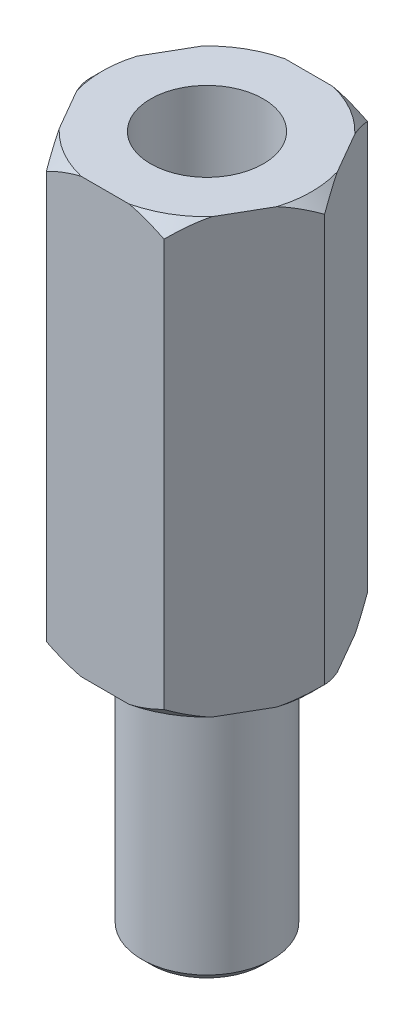
from build123d import *

# Parameters (mm, degrees)
SKETCH1_R                = 1.3
BOSS_EXTRUDE1_DEPTH      = 10
BOSS_EXTRUDE2_DEPTH      = 6
BOSS_EXTRUDE2_DEPTH_BACK = 2
SKETCH2_R                = 1.5
CHAMFER1_SIZE            = 0.2


with BuildPart() as part:
    # Sketch1 → Boss-Extrude1 (new body)
    with BuildSketch(Plane(origin=(0, 0, 0), x_dir=(1, 0, 0), z_dir=(0, 1, 0))):
        Polygon((-2.713546265, 0), (-1.356773133, -2.35), (1.356773133, -2.35), (2.713546265, 0), (1.356773133, 2.35), (-1.356773133, 2.35), align=None)
        with Locations(Location((0, 0, 0), (0, 0, 270))):
            Circle(SKETCH1_R, mode=Mode.SUBTRACT)
    extrude(amount=BOSS_EXTRUDE1_DEPTH)

    # Sketch2 → Boss-Extrude2 (add, two sides: drawn at the far end of the back side and taken through both)
    with BuildSketch(Plane.XZ.offset(-BOSS_EXTRUDE2_DEPTH_BACK)):
        with Locations(Location((0, 0, 0), (0, 0, 270))):
            Circle(SKETCH2_R)
    extrude(amount=BOSS_EXTRUDE2_DEPTH + BOSS_EXTRUDE2_DEPTH_BACK)

    # Chamfer1
    chamfer1_edges = [part.edges().sort_by_distance(p)[0] for p in [
        (0, -6, 1.5),
    ]]
    chamfer(chamfer1_edges, length=CHAMFER1_SIZE)

    # Sketch6 → Cut-Revolve1 (revolve, cut)
    with BuildSketch(Plane.XY, mode=Mode.PRIVATE) as cut_revolve1_sk:
        Polygon((-2.713546265, 10), (-2.713546265, 9.7), (-2.413546265, 10), align=None)
        Polygon((-2.413546265, 0), (-2.713546265, 0), (-2.713546265, 0.3), align=None)
    revolve(cut_revolve1_sk.sketch.rotate(Axis((0, 0, 0), (0, 1, 0)), 270), axis=Axis((0, 0, 0), (0, 1, 0)), mode=Mode.SUBTRACT)


solid = part.part
